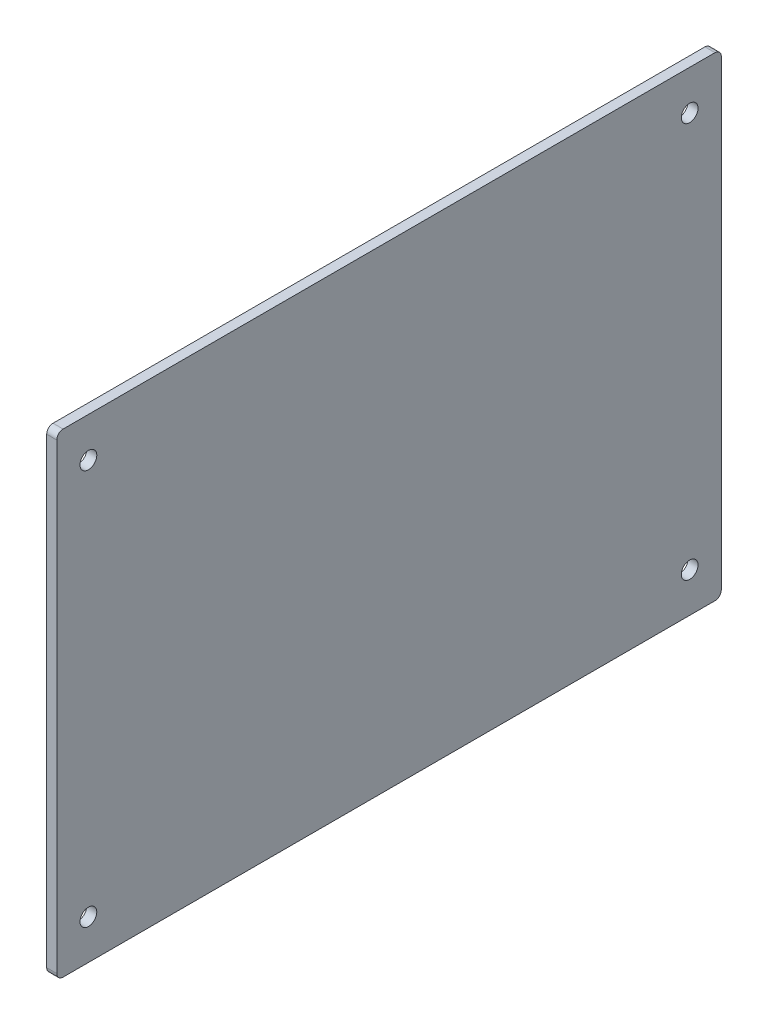
from build123d import *

# Parameters (mm, degrees)
SKETCH2_W            = 210
SKETCH2_H            = 150
BOSS_EXTRUDE1_DEPTH  = 3.175
M5_CLEARANCE_HOLE2_D = 5.3
FILLET2_R            = 2


with BuildPart() as part:
    # Sketch2 → Boss-Extrude1 (new body)
    with BuildSketch(Plane(origin=(0, 0, 0), x_dir=(0, 0, -1), z_dir=(1, 0, 0))):
        Rectangle(SKETCH2_W, SKETCH2_H)
    extrude(amount=BOSS_EXTRUDE1_DEPTH)

    # M5 Clearance Hole2 (through all)
    with Locations(Plane(origin=(3.175, 0, 0), x_dir=(0, 0, -1), z_dir=(1, 0, 0))):
        with Locations((-95, 62.5), (95, 62.5), (-95, -62.5), (95, -62.5)):
            Hole(M5_CLEARANCE_HOLE2_D / 2)

    # Fillet2
    fillet2_edges = [part.edges().sort_by_distance(p)[0] for p in [
        (1.5875, -75, -105),
        (1.5875, -75, 105),
        (1.5875, 75, 105),
        (1.5875, 75, -105),
    ]]
    fillet(fillet2_edges, radius=FILLET2_R)


solid = part.part
